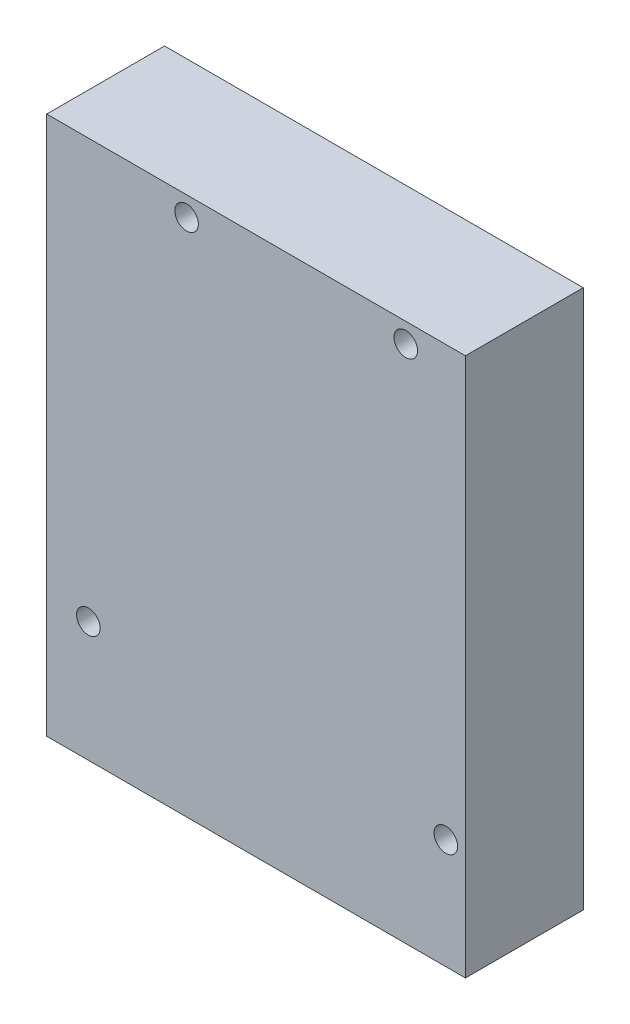
from build123d import *

# Parameters (mm, degrees)
SKETCH_1_W      = 53.3
SKETCH_1_H      = 68.6
SKETCH_1_R      = 1.5
EXTRUDE_1_DEPTH = 15


with BuildPart() as part:
    # 草图1 → 凸台-拉伸1 (new body)
    with BuildSketch(Plane.XY):
        with Locations((-11.140811044, 19.148070952)):
            Rectangle(SKETCH_1_W, SKETCH_1_H)
        with Locations((-19.990811044, 50.948070952)):
            Circle(SKETCH_1_R, mode=Mode.SUBTRACT)
        with Locations((7.909188956, 50.948070952)):
            Circle(SKETCH_1_R, mode=Mode.SUBTRACT)
        with Locations((-32.490811044, 0.148070952)):
            Circle(SKETCH_1_R, mode=Mode.SUBTRACT)
        with Locations((13.009188956, -1.151929048)):
            Circle(SKETCH_1_R, mode=Mode.SUBTRACT)
    extrude(amount=EXTRUDE_1_DEPTH)


solid = part.part
